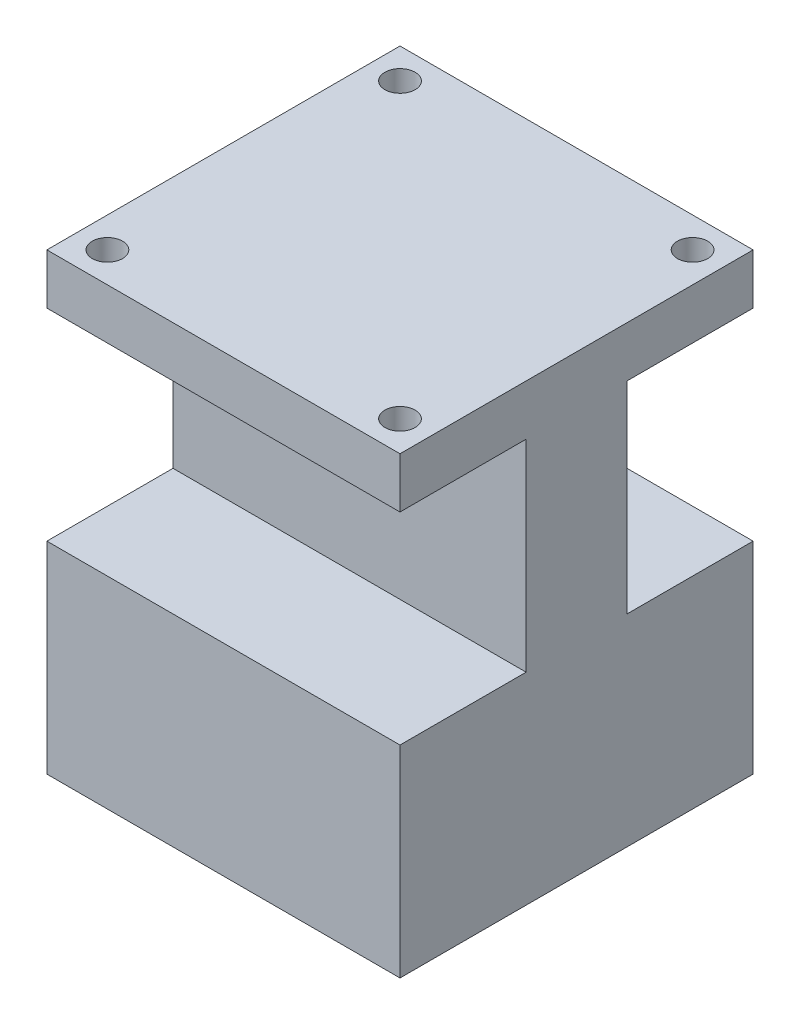
from build123d import *

# Parameters (mm, degrees)
SKETCH1_W           = 35
SKETCH1_H           = 35
BOSS_EXTRUDE2_DEPTH = 20
SKETCH2_W           = 35
SKETCH2_H           = 10
BOSS_EXTRUDE3_DEPTH = 20
SKETCH3_W           = 35
SKETCH3_H           = 35
BOSS_EXTRUDE4_DEPTH = 5
CUT_EXTRUDE1_REACH  = 53.357
SKETCH4_R           = 1.5


with BuildPart() as part:
    # Sketch1 → Boss-Extrude2 (new body)
    with BuildSketch(Plane(origin=(0, 0, 0), x_dir=(1, 0, 0), z_dir=(0, 1, 0))):
        Rectangle(SKETCH1_W, SKETCH1_H)
    extrude(amount=BOSS_EXTRUDE2_DEPTH)

    # Sketch2 → Boss-Extrude3 (add)
    with BuildSketch(Plane(origin=(0, 20, 0), x_dir=(1, 0, 0), z_dir=(0, 1, 0))):
        Rectangle(SKETCH2_W, SKETCH2_H)
    extrude(amount=BOSS_EXTRUDE3_DEPTH)

    # Sketch3 → Boss-Extrude4 (add)
    with BuildSketch(Plane(origin=(0, 40, 0), x_dir=(1, 0, 0), z_dir=(0, 1, 0))):
        Rectangle(SKETCH3_W, SKETCH3_H)
    extrude(amount=BOSS_EXTRUDE4_DEPTH)

    # Sketch4 → Cut-Extrude1 (cut, up to next)
    with BuildSketch(Plane(origin=(0, 45, 0), x_dir=(1, 0, 0), z_dir=(0, 1, 0)), mode=Mode.PRIVATE) as cut_extrude1_sk1:
        with Locations(Location((-14.5, 14.5, 0), (0, 0, 270))):
            Circle(SKETCH4_R)
    cut_extrude1_tool1 = extrude(cut_extrude1_sk1.sketch, amount=-CUT_EXTRUDE1_REACH, mode=Mode.PRIVATE) & part.part
    # Sketch4 → Cut-Extrude1 (cut, up to next)
    with BuildSketch(Plane(origin=(0, 45, 0), x_dir=(1, 0, 0), z_dir=(0, 1, 0)), mode=Mode.PRIVATE) as cut_extrude1_sk2:
        with Locations(Location((14.5, 14.5, 0), (0, 0, 270))):
            Circle(SKETCH4_R)
    cut_extrude1_tool2 = extrude(cut_extrude1_sk2.sketch, amount=-CUT_EXTRUDE1_REACH, mode=Mode.PRIVATE) & part.part
    # Sketch4 → Cut-Extrude1 (cut, up to next)
    with BuildSketch(Plane(origin=(0, 45, 0), x_dir=(1, 0, 0), z_dir=(0, 1, 0)), mode=Mode.PRIVATE) as cut_extrude1_sk3:
        with Locations(Location((14.5, -14.5, 0), (0, 0, 270))):
            Circle(SKETCH4_R)
    cut_extrude1_tool3 = extrude(cut_extrude1_sk3.sketch, amount=-CUT_EXTRUDE1_REACH, mode=Mode.PRIVATE) & part.part
    # Sketch4 → Cut-Extrude1 (cut, up to next)
    with BuildSketch(Plane(origin=(0, 45, 0), x_dir=(1, 0, 0), z_dir=(0, 1, 0)), mode=Mode.PRIVATE) as cut_extrude1_sk4:
        with Locations(Location((-14.5, -14.5, 0), (0, 0, 270))):
            Circle(SKETCH4_R)
    cut_extrude1_tool4 = extrude(cut_extrude1_sk4.sketch, amount=-CUT_EXTRUDE1_REACH, mode=Mode.PRIVATE) & part.part
    add(cut_extrude1_tool1.solids().sort_by_distance((-14.5, 45, -14.5))[0], mode=Mode.SUBTRACT)
    add(cut_extrude1_tool2.solids().sort_by_distance((14.5, 45, -14.5))[0], mode=Mode.SUBTRACT)
    add(cut_extrude1_tool3.solids().sort_by_distance((14.5, 45, 14.5))[0], mode=Mode.SUBTRACT)
    add(cut_extrude1_tool4.solids().sort_by_distance((-14.5, 45, 14.5))[0], mode=Mode.SUBTRACT)


solid = part.part
